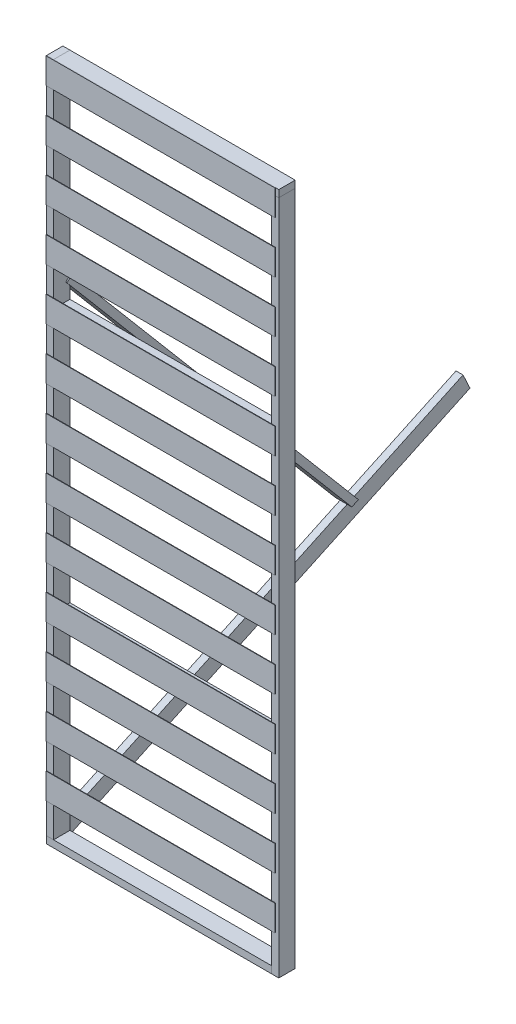
from build123d import *

# Parameters (mm, degrees)
PROFILES_2X4_1_DEPTH       = 1238.25
PROFILES_2X4_1_DEPTH_BACK  = 1
SKETCH_2X4_W               = 38.1
SKETCH_2X4_H               = 88.9
SKETCH_2X4_ON_SEGMENT_2_W  = 38.1
SKETCH_2X4_ON_SEGMENT_2_H  = 88.9
PROFILES_2X4_1_2_DEPTH     = 3677.65
SKETCH_2X4_ON_SEGMENT_3_W  = 38.1
SKETCH_2X4_ON_SEGMENT_3_H  = 88.9
PROFILES_2X4_1_3_DEPTH     = 1239.25
SKETCH_2X4_ON_SEGMENT_4_W  = 38.1
SKETCH_2X4_ON_SEGMENT_4_H  = 88.9
PROFILES_2X4_1_4_DEPTH     = 3677.65
SKETCH_2X4_ON_SEGMENT_5_W  = 38.1
SKETCH_2X4_ON_SEGMENT_5_H  = 88.9
PROFILES_2X4_1_5_DEPTH     = 1221.2
SKETCH_2X4_ON_SEGMENT_6_W  = 38.1
SKETCH_2X4_ON_SEGMENT_6_H  = 88.9
PROFILES_2X4_1_6_DEPTH     = 1221.2
SKETCH4_W                  = 1238.25
SKETCH4_H                  = 139.7
BOSS_EXTRUDE1_DEPTH        = 2.54
LPATTERN1_COUNT            = 13
LPATTERN1_PITCH            = 279.4
SKETCH_2X41_W              = 38.1
SKETCH_2X41_H              = 88.9
PROFILES_2X4_3_DEPTH       = 2438.4
SKETCH_2X41_ON_SEGMENT_2_W = 38.1
SKETCH_2X41_ON_SEGMENT_2_H = 88.9
PROFILES_2X4_3_2_DEPTH     = 2452.579479335


with BuildPart() as part:
    # 2x4 → Profiles 2X4(1) (new, two sides: drawn at the far end of the back side and taken through both)
    with BuildSketch(Plane(origin=(-609.6, 1828.8, 0), x_dir=(0, 1, 0), z_dir=(1, 0, 0)).offset(-PROFILES_2X4_1_DEPTH_BACK)):
        Rectangle(SKETCH_2X4_W, SKETCH_2X4_H)
    extrude(amount=PROFILES_2X4_1_DEPTH + PROFILES_2X4_1_DEPTH_BACK)

    # Profiles 2X4(1) end butt 1
    split(bisect_by=Plane(origin=(-590.55, 1828.8, 0), x_dir=(0, 1, 0), z_dir=(1, 0, 0)), keep=Keep.TOP)


with BuildPart() as body_2:
    # 2x4 on segment 2 (carried to segment 2) → Profiles 2X4_1 2 (new body)
    with BuildSketch(Plane(origin=(609.6, 1829.8, 0), x_dir=(1, 0, 0), z_dir=(0, -1, 0))):
        Rectangle(SKETCH_2X4_ON_SEGMENT_2_W, SKETCH_2X4_ON_SEGMENT_2_H)
    extrude(amount=PROFILES_2X4_1_2_DEPTH)

    # Profiles 2X4_1 2 end butt 1
    split(bisect_by=Plane(origin=(609.6, 1809.75, 0), x_dir=(1, 0, 0), z_dir=(0, -1, 0)), keep=Keep.TOP)


with BuildPart() as body_3:
    # 2x4 on segment 3 (carried to segment 3) → Profiles 2X4_1 3 (new body)
    with BuildSketch(Plane(origin=(610.6, -1828.8, 0), x_dir=(0, -1, 0), z_dir=(-1, 0, 0))):
        Rectangle(SKETCH_2X4_ON_SEGMENT_3_W, SKETCH_2X4_ON_SEGMENT_3_H)
    extrude(amount=PROFILES_2X4_1_3_DEPTH)

    # Profiles 2X4_1 3 end butt 1
    split(bisect_by=Plane(origin=(590.55, -1828.8, 0), x_dir=(0, -1, 0), z_dir=(-1, 0, 0)), keep=Keep.TOP)


with BuildPart() as body_4:
    # 2x4 on segment 4 (carried to segment 4) → Profiles 2X4_1 4 (new body)
    with BuildSketch(Plane(origin=(-609.6, -1829.8, 0), x_dir=(-1, 0, 0), z_dir=(0, 1, 0))):
        Rectangle(SKETCH_2X4_ON_SEGMENT_4_W, SKETCH_2X4_ON_SEGMENT_4_H)
    extrude(amount=PROFILES_2X4_1_4_DEPTH)

    # Profiles 2X4_1 4 end butt 1
    split(bisect_by=Plane(origin=(-609.6, -1809.75, 0), x_dir=(-1, 0, 0), z_dir=(0, 1, 0)), keep=Keep.TOP)


with BuildPart() as body_5:
    # 2x4 on segment 5 (carried to segment 5) → Profiles 2X4_1 5 (new body)
    with BuildSketch(Plane(origin=(-610.6, 660.4, 0), x_dir=(0, 1, 0), z_dir=(1, 0, 0))):
        Rectangle(SKETCH_2X4_ON_SEGMENT_5_W, SKETCH_2X4_ON_SEGMENT_5_H)
    extrude(amount=PROFILES_2X4_1_5_DEPTH)

    # Profiles 2X4_1 5 end butt 1
    split(bisect_by=Plane(origin=(-590.55, 660.4, 0), x_dir=(0, 1, 0), z_dir=(1, 0, 0)), keep=Keep.TOP)

    # Profiles 2X4_1 5 end butt 2
    split(bisect_by=Plane(origin=(590.55, 660.4, 0), x_dir=(0, -1, 0), z_dir=(-1, 0, 0)), keep=Keep.TOP)


with BuildPart() as body_6:
    # 2x4 on segment 6 (carried to segment 6) → Profiles 2X4_1 6 (new body)
    with BuildSketch(Plane(origin=(-610.6, -762, 0), x_dir=(0, 1, 0), z_dir=(1, 0, 0))):
        Rectangle(SKETCH_2X4_ON_SEGMENT_6_W, SKETCH_2X4_ON_SEGMENT_6_H)
    extrude(amount=PROFILES_2X4_1_6_DEPTH)

    # Profiles 2X4_1 6 end butt 1
    split(bisect_by=Plane(origin=(-590.55, -762, 0), x_dir=(0, 1, 0), z_dir=(1, 0, 0)), keep=Keep.TOP)

    # Profiles 2X4_1 6 end butt 2
    split(bisect_by=Plane(origin=(590.55, -762, 0), x_dir=(0, -1, 0), z_dir=(-1, 0, 0)), keep=Keep.TOP)


with BuildPart() as body_7:
    # Sketch4 → Boss-Extrude1 (new body)
    with BuildSketch(Plane.XY.offset(44.45)):
        with Locations((-9.525, 1778)):
            Rectangle(SKETCH4_W, SKETCH4_H)
    boss_extrude1 = extrude(amount=BOSS_EXTRUDE1_DEPTH)


with BuildPart() as lpattern1_1:
    # LPattern1: Boss-Extrude1 ×13
    with Locations(*[(0, -i * LPATTERN1_PITCH, 0) for i in range(1, LPATTERN1_COUNT)]):
        add(boss_extrude1)


with BuildPart() as body_20:
    # 2x41 → Profiles 2X4(3) (new body)
    with BuildSketch(Plane(origin=(-628.65, -1828.8, 0), x_dir=(-1, 0, 0), z_dir=(0, 0.4226182617406972, -0.906307787036651))):
        Rectangle(SKETCH_2X41_W, SKETCH_2X41_H)
    extrude(amount=PROFILES_2X4_3_DEPTH)


with BuildPart() as body_21:
    # 2x41 on segment 2 (carried to segment 2) → Profiles 2X4_3 2 (new body)
    with BuildSketch(Plane(origin=(-628.65, 783.833347216, -36.086128399), x_dir=(0, -0.646050327, 0.763294815), z_dir=(0, -0.763294815, -0.646050327))):
        Rectangle(SKETCH_2X41_ON_SEGMENT_2_W, SKETCH_2X41_ON_SEGMENT_2_H)
    extrude(amount=PROFILES_2X4_3_2_DEPTH)

    # Profiles 2X4_3 2 end butt 1
    split(bisect_by=Plane(origin=(-628.65, -1037.099349491, -1592.629863617), x_dir=(-1, 0, 0), z_dir=(0, 0.906307787, 0.422618262)), keep=Keep.TOP)


solid = Compound([part.part, body_2.part, body_3.part, body_4.part, body_5.part, body_6.part, body_7.part, lpattern1_1.part, body_20.part, body_21.part])
